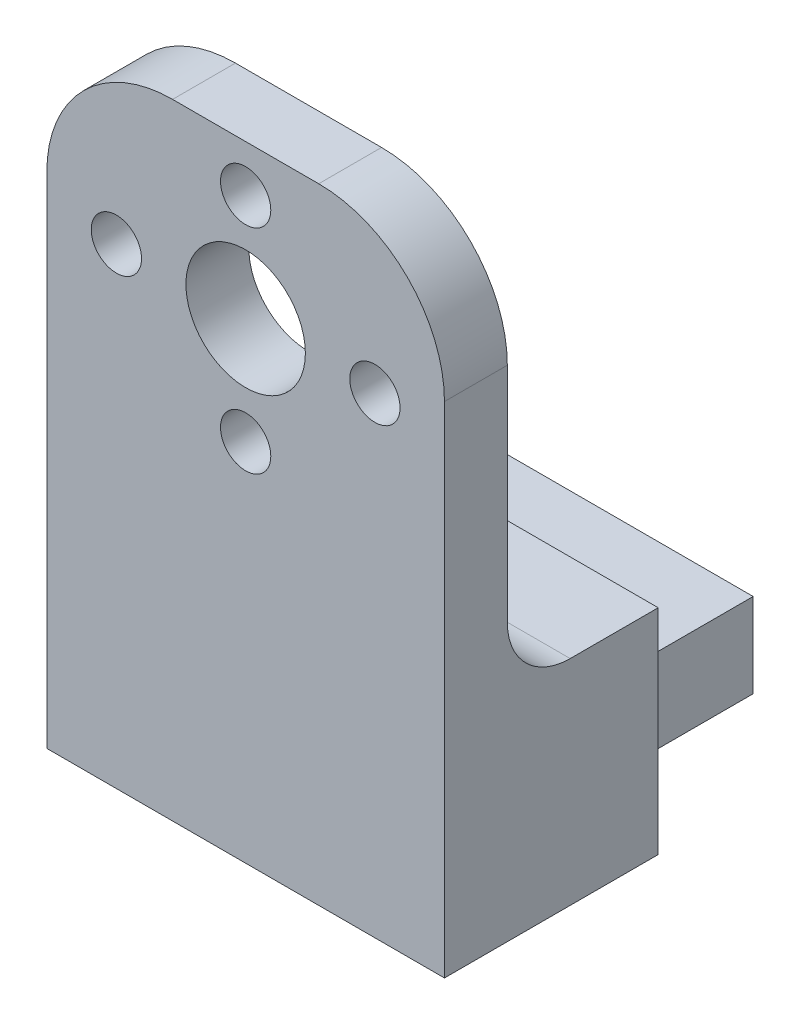
from build123d import *

# Parameters (mm, degrees)
SKETCH1_W           = 31.62
SKETCH1_H           = 17
BOSS_EXTRUDE1_DEPTH = 17
SKETCH2_W           = 27.32
SKETCH2_H           = 6.7
BOSS_EXTRUDE2_DEPTH = 9.7
SKETCH3_W           = 31.62
SKETCH3_H           = 5
BOSS_EXTRUDE3_DEPTH = 32.7
SKETCH4_R           = 2
SKETCH4_R_2         = 4.75
CUT_EXTRUDE1_DEPTH  = 5
FILLET1_R           = 10
FILLET2_R           = 5


with BuildPart() as part:
    # Sketch1 → Boss-Extrude1 (new body)
    with BuildSketch(Plane(origin=(0, 0, 0), x_dir=(1, 0, 0), z_dir=(0, 1, 0))):
        Rectangle(SKETCH1_W, SKETCH1_H)
    extrude(amount=BOSS_EXTRUDE1_DEPTH)

    # Sketch2 → Boss-Extrude2 (add)
    with BuildSketch(Plane(origin=(0, 0, -8.5), x_dir=(-1, 0, 0), z_dir=(0, 0, -1))):
        with Locations((0, 8.5)):
            Rectangle(SKETCH2_W, SKETCH2_H)
    extrude(amount=BOSS_EXTRUDE2_DEPTH)

    # Sketch3 → Boss-Extrude3 (add)
    with BuildSketch(Plane(origin=(0, 17, 0), x_dir=(1, 0, 0), z_dir=(0, 1, 0))):
        with Locations((0, -6)):
            Rectangle(SKETCH3_W, SKETCH3_H)
    extrude(amount=BOSS_EXTRUDE3_DEPTH)

    # Sketch4 → Cut-Extrude1 (cut)
    with BuildSketch(Plane.XY.offset(8.5)):
        with Locations((0, 29.025)):
            Circle(SKETCH4_R)
        with Locations((-10.28, 37.5)):
            Circle(SKETCH4_R)
        with Locations((0, 45.975)):
            Circle(SKETCH4_R)
        with Locations(Location((10.28, 37.5, 0), (0, 0, 180))):
            Circle(SKETCH4_R)
        with Locations((0, 37.5)):
            Circle(SKETCH4_R_2)
    extrude(amount=-CUT_EXTRUDE1_DEPTH, mode=Mode.SUBTRACT)

    # Fillet1
    fillet1_edges = [part.edges().sort_by_distance(p)[0] for p in [
        (15.81, 49.7, 6),
        (-15.81, 49.7, 6),
    ]]
    fillet(fillet1_edges, radius=FILLET1_R)

    # Fillet2
    fillet2_edges = [part.edges().sort_by_distance(p)[0] for p in [
        (0, 17, 3.5),
    ]]
    fillet(fillet2_edges, radius=FILLET2_R)


solid = part.part
